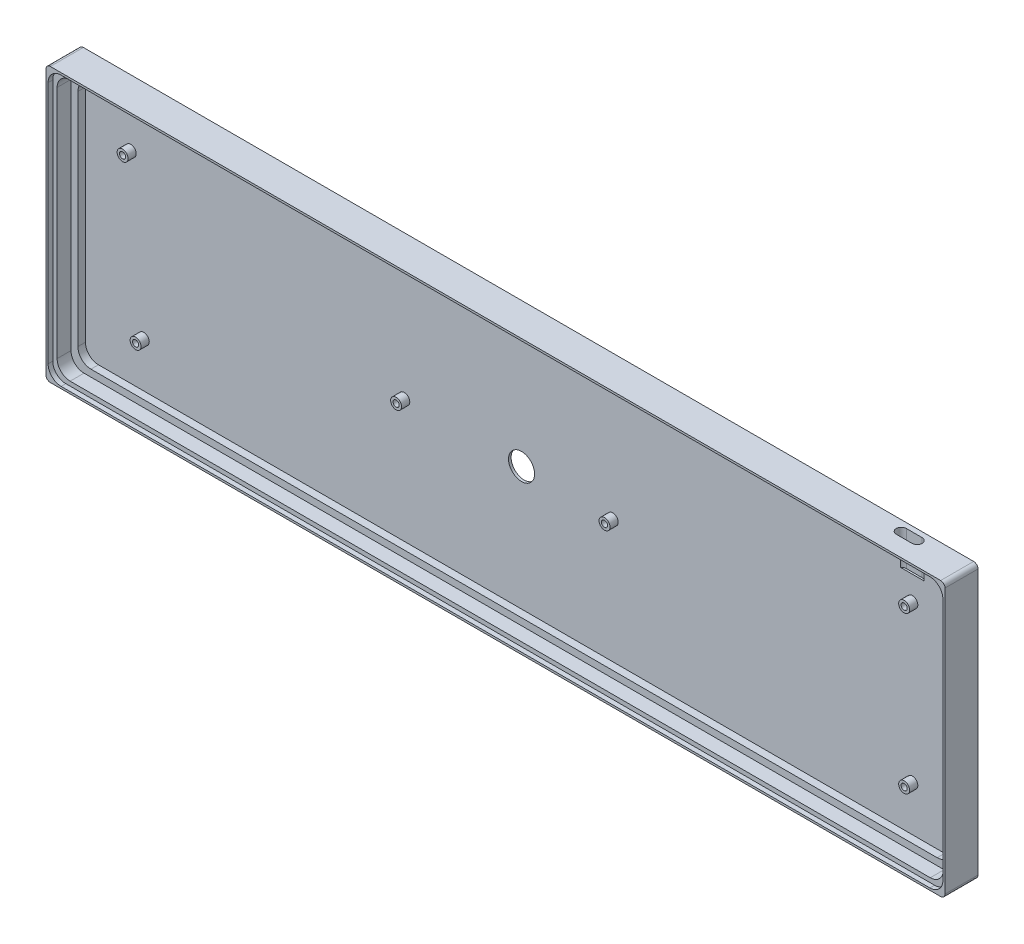
from build123d import *

# Parameters (mm, degrees)
SKETCH1_W           = 328.676
SKETCH1_H           = 100.076
SKETCH1_W_2         = 327.152
SKETCH1_H_2         = 98.552
SKETCH1_W_3         = 323.977
SKETCH1_H_3         = 95.377
SKETCH1_W_4         = 318.897
SKETCH1_H_4         = 90.297
BOSS_EXTRUDE1_DEPTH = 2.54
SKETCH1_3_W         = 328.676
SKETCH1_3_H         = 100.076
SKETCH1_3_W_2       = 327.152
SKETCH1_3_H_2       = 98.552
BOSS_EXTRUDE2_DEPTH = 12.065
SKETCH1_4_W         = 327.152
SKETCH1_4_H         = 98.552
SKETCH1_4_W_2       = 323.977
SKETCH1_4_H_2       = 95.377
BOSS_EXTRUDE3_DEPTH = 10.3505
SKETCH1_5_W         = 323.977
SKETCH1_5_H         = 95.377
SKETCH1_5_W_2       = 318.897
SKETCH1_5_H_2       = 90.297
BOSS_EXTRUDE4_DEPTH = 5.2832
SKETCH2_R           = 1.99999981
SKETCH2_R_2         = 1.130554
BOSS_EXTRUDE5_DEPTH = 2.9972
FILLET1_R           = 4.7625
FILLET2_R           = 1.5875
CUT_EXTRUDE1_DEPTH  = 1.5875
SKETCH4_R           = 4.7625
CUT_EXTRUDE2_DEPTH  = 173.050880012
CUT_EXTRUDE3_DEPTH  = 12.7
CUT_EXTRUDE4_START  = -1.58
CUT_EXTRUDE4_DEPTH  = 6.6473
SKETCH7_R           = 4.826
CUT_EXTRUDE5_DEPTH  = 1.27


with BuildPart() as part:
    # Sketch1 → Boss-Extrude1 (new body)
    # profile 1 of 4: a face of its own
    with BuildSketch(Plane.XY):
        Rectangle(SKETCH1_W, SKETCH1_H)
        Rectangle(SKETCH1_W_2, SKETCH1_H_2, mode=Mode.SUBTRACT)
    # profile 2 of 4: a face of its own
    with BuildSketch(Plane.XY):
        Rectangle(SKETCH1_W_2, SKETCH1_H_2)
        Rectangle(SKETCH1_W_3, SKETCH1_H_3, mode=Mode.SUBTRACT)
    # profile 3 of 4: a face of its own
    with BuildSketch(Plane.XY):
        Rectangle(SKETCH1_W_3, SKETCH1_H_3)
    # profile 4 of 4: a face of its own
    with BuildSketch(Plane.XY):
        Rectangle(SKETCH1_W_4, SKETCH1_H_4)
    extrude(amount=BOSS_EXTRUDE1_DEPTH)

    # Sketch1<3> → Boss-Extrude2 (add)
    with BuildSketch(Plane.XY):
        Rectangle(SKETCH1_3_W, SKETCH1_3_H)
        Rectangle(SKETCH1_3_W_2, SKETCH1_3_H_2, mode=Mode.SUBTRACT)
    extrude(amount=BOSS_EXTRUDE2_DEPTH)

    # Sketch1<4> → Boss-Extrude3 (add)
    with BuildSketch(Plane.XY):
        Rectangle(SKETCH1_4_W, SKETCH1_4_H)
        Rectangle(SKETCH1_4_W_2, SKETCH1_4_H_2, mode=Mode.SUBTRACT)
    extrude(amount=BOSS_EXTRUDE3_DEPTH)

    # Sketch1<5> → Boss-Extrude4 (add)
    with BuildSketch(Plane.XY):
        Rectangle(SKETCH1_5_W, SKETCH1_5_H)
        Rectangle(SKETCH1_5_W_2, SKETCH1_5_H_2, mode=Mode.SUBTRACT)
    extrude(amount=BOSS_EXTRUDE4_DEPTH)

    # Sketch2 → Boss-Extrude5 (add)
    # profile 1 of 6: a face of its own
    with BuildSketch(Plane.XY.offset(2.54)):
        with Locations((142.875, -28.575)):
            Circle(SKETCH2_R)
        with Locations((142.875, -28.575)):
            Circle(SKETCH2_R_2, mode=Mode.SUBTRACT)
    # profile 2 of 6: a face of its own
    with BuildSketch(Plane.XY.offset(2.54)):
        with Locations((142.875, 28.575)):
            Circle(SKETCH2_R)
        with Locations((142.875, 28.575)):
            Circle(SKETCH2_R_2, mode=Mode.SUBTRACT)
    # profile 3 of 6: a face of its own
    with BuildSketch(Plane.XY.offset(2.54)):
        with Locations((-42.8625, 0)):
            Circle(SKETCH2_R)
        with Locations((-42.8625, 0)):
            Circle(SKETCH2_R_2, mode=Mode.SUBTRACT)
    # profile 4 of 6: a face of its own
    with BuildSketch(Plane.XY.offset(2.54)):
        with Locations((33.3375, 0)):
            Circle(SKETCH2_R)
        with Locations((33.3375, 0)):
            Circle(SKETCH2_R_2, mode=Mode.SUBTRACT)
    # profile 5 of 6: a face of its own
    with BuildSketch(Plane.XY.offset(2.54)):
        with Locations((-142.875, 28.575)):
            Circle(SKETCH2_R)
        with Locations((-142.875, 28.575)):
            Circle(SKETCH2_R_2, mode=Mode.SUBTRACT)
    # profile 6 of 6: a face of its own
    with BuildSketch(Plane.XY.offset(2.54)):
        with Locations((-138.1125, -28.575)):
            Circle(SKETCH2_R)
        with Locations((-138.1125, -28.575)):
            Circle(SKETCH2_R_2, mode=Mode.SUBTRACT)
    extrude(amount=BOSS_EXTRUDE5_DEPTH)

    # Fillet1
    fillet1_edges = [part.edges().sort_by_distance(p)[0] for p in [
        (159.4485, 45.1485, 3.9116),
        (159.4485, -45.1485, 3.9116),
        (-159.4485, -45.1485, 3.9116),
        (-159.4485, 45.1485, 3.9116),
        (163.576, -49.276, 11.20775),
        (-163.576, -49.276, 11.20775),
        (-163.576, 49.276, 11.20775),
        (163.576, 49.276, 11.20775),
        (161.9885, 47.6885, 7.81685),
        (-161.9885, 47.6885, 7.81685),
        (-161.9885, -47.6885, 7.81685),
        (161.9885, -47.6885, 7.81685),
    ]]
    fillet(fillet1_edges, radius=FILLET1_R)

    # Fillet2
    fillet2_edges = [part.edges().sort_by_distance(p)[0] for p in [
        (-164.338, -50.038, 6.0325),
        (-164.338, 50.038, 6.0325),
        (164.338, 50.038, 6.0325),
        (164.338, -50.038, 6.0325),
    ]]
    fillet(fillet2_edges, radius=FILLET2_R)

    # Sketch3 → Cut-Extrude1 (cut)
    with BuildSketch(Plane(origin=(0, 0, 0), x_dir=(-1, 0, 0), z_dir=(0, 0, -1))):
        with BuildLine():
            Line((-26.9875, -15.875), (26.9875, -15.875))
            ThreePointArc((26.9875, -15.875), (29.23256403, -14.94506403), (30.1625, -12.7))
            Line((30.1625, -12.7), (30.1625, 12.7))
            ThreePointArc((30.1625, 12.7), (29.23256403, 14.94506403), (26.9875, 15.875))
            Line((26.9875, 15.875), (-26.9875, 15.875))
            ThreePointArc((-26.9875, 15.875), (-29.23256403, 14.94506403), (-30.1625, 12.7))
            Line((-30.1625, 12.7), (-30.1625, -12.7))
            ThreePointArc((-30.1625, -12.7), (-29.23256403, -14.94506403), (-26.9875, -15.875))
        make_face()
    extrude(amount=-CUT_EXTRUDE1_DEPTH, mode=Mode.SUBTRACT)

    # Sketch4 → Cut-Extrude2 (cut, through all)
    with BuildSketch(Plane.XY.offset(2.54)):
        Circle(SKETCH4_R)
    extrude(amount=-CUT_EXTRUDE2_DEPTH, mode=Mode.SUBTRACT)

    # Sketch5 → Cut-Extrude3 (cut)
    with BuildSketch(Plane(origin=(0, 50.038, 0), x_dir=(1, 0, 0), z_dir=(0, 1, 0))):
        with BuildLine():
            Line((145.765, -5.5372), (139.985, -5.5372))
            ThreePointArc((139.985, -5.5372), (138.151, -3.7032), (139.985, -1.8692))
            Line((139.985, -1.8692), (145.765, -1.8692))
            ThreePointArc((145.765, -1.8692), (147.599, -3.7032), (145.765, -5.5372))
        make_face()
    extrude(amount=-CUT_EXTRUDE3_DEPTH, mode=Mode.SUBTRACT)

    # Sketch6 → Cut-Extrude4 (cut)
    with BuildSketch(Plane.XY.offset(5.2832).offset(CUT_EXTRUDE4_START)):
        with BuildLine():
            Line((138.151, 45.1485), (147.599, 45.1485))
            Line((147.599, 45.1485), (147.599, 46.89475))
            ThreePointArc((147.599, 46.89475), (147.134032015, 48.017282015), (146.0115, 48.48225))
            Line((146.0115, 48.48225), (139.7385, 48.48225))
            ThreePointArc((139.7385, 48.48225), (138.615967985, 48.017282015), (138.151, 46.89475))
            Line((138.151, 46.89475), (138.151, 45.1485))
        make_face()
    extrude(amount=CUT_EXTRUDE4_DEPTH, mode=Mode.SUBTRACT)

    # Sketch7 → Cut-Extrude5 (cut)
    with BuildSketch(Plane(origin=(0, 0, 0), x_dir=(-1, 0, 0), z_dir=(0, 0, -1))):
        with Locations((-157.988, 43.688)):
            Circle(SKETCH7_R)
        with Locations((-157.988, -43.688)):
            Circle(SKETCH7_R)
        with Locations((157.988, -43.688)):
            Circle(SKETCH7_R)
        with Locations((157.988, 43.688)):
            Circle(SKETCH7_R)
    extrude(amount=-CUT_EXTRUDE5_DEPTH, mode=Mode.SUBTRACT)


solid = part.part
